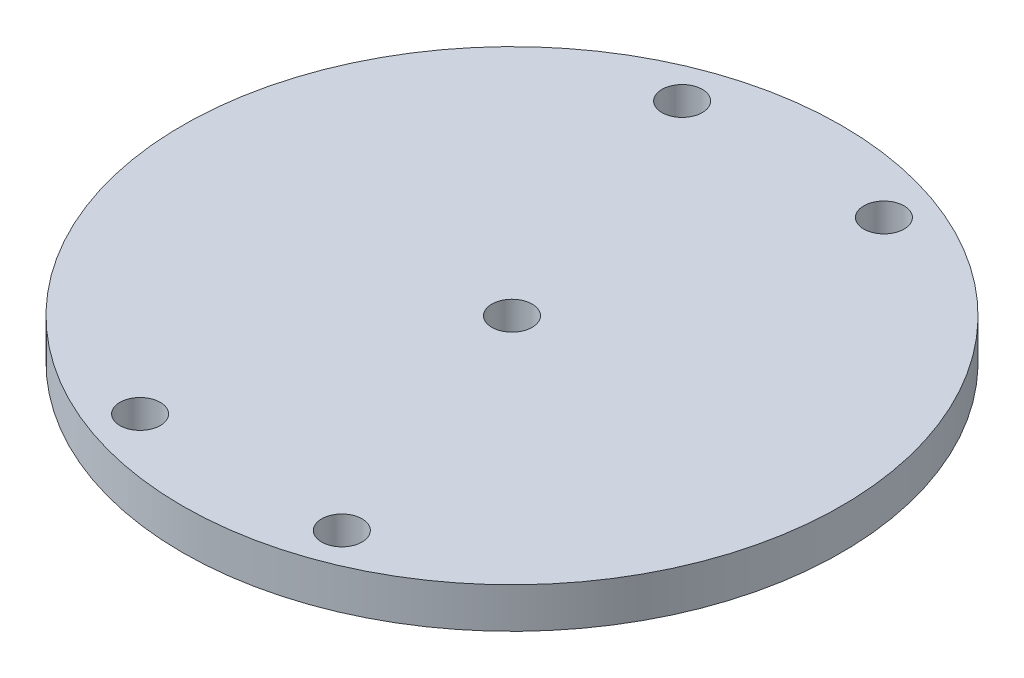
from build123d import *

# Parameters (mm, degrees)
SKETCH1_R           = 49
BOSS_EXTRUDE1_DEPTH = 6
SKETCH2_R           = 3
CUT_EXTRUDE1_DEPTH  = 6


with BuildPart() as part:
    # Sketch1 → Boss-Extrude1 (new body)
    with BuildSketch(Plane(origin=(0, 0, 0), x_dir=(1, 0, 0), z_dir=(0, 1, 0))):
        with Locations(Location((0, 0, 0), (0, 0, 270))):
            Circle(SKETCH1_R)
    extrude(amount=BOSS_EXTRUDE1_DEPTH)

    # Sketch2 → Cut-Extrude1 (cut)
    with BuildSketch(Plane(origin=(0, 6, 0), x_dir=(1, 0, 0), z_dir=(0, 1, 0))):
        with Locations(Location((-15, 40.298883359, 0), (0, 0, 270))):
            Circle(SKETCH2_R)
        with Locations(Location((15, 40.298883359, 0), (0, 0, 270))):
            Circle(SKETCH2_R)
        with Locations(Location((0, 0, 0), (0, 0, 270))):
            Circle(SKETCH2_R)
        with Locations(Location((15, -40.298883359, 0), (0, 0, 270))):
            Circle(SKETCH2_R)
        with Locations(Location((-15, -40.298883359, 0), (0, 0, 270))):
            Circle(SKETCH2_R)
    extrude(amount=-CUT_EXTRUDE1_DEPTH, mode=Mode.SUBTRACT)


solid = part.part
